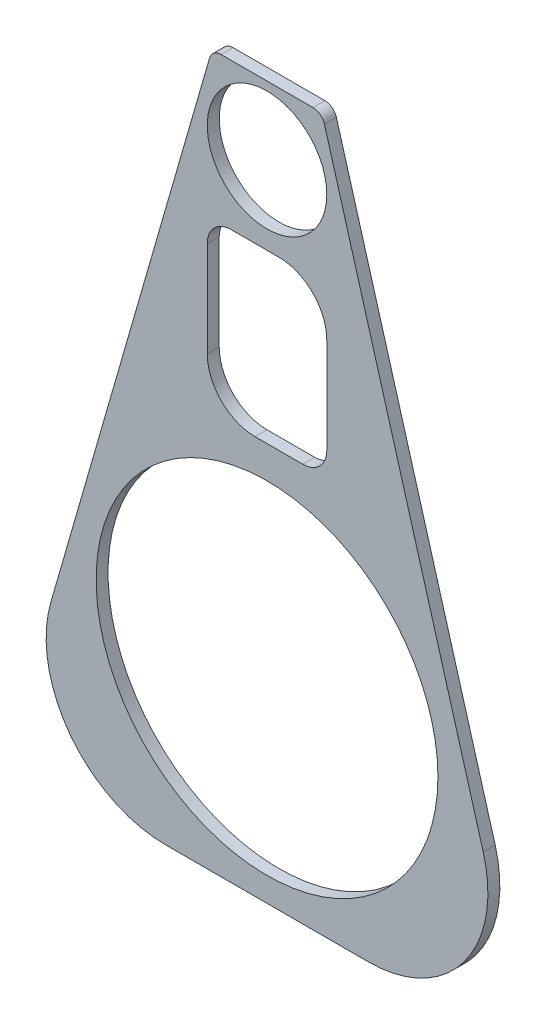
from build123d import *

# Parameters (mm, degrees)
SKETCH3_R           = 250
SKETCH3_R_2         = 715
BOSS_EXTRUDE1_DEPTH = 50


with BuildPart() as part:
    # Sketch3 → Boss-Extrude1 (new body)
    with BuildSketch(Plane.XY):
        with BuildLine():
            Line((969.886005152, -1066.457437193), (305.514251949, 1238.373568318))
            ThreePointArc((305.514251949, 1238.373568318), (287.533352897, 1264.477537776), (257.470390227, 1274.524837297))
            Line((257.470390227, 1274.524837297), (-126.839292875, 1274.524837297))
            ThreePointArc((-126.839292875, 1274.524837297), (-156.902255545, 1264.477537776), (-174.883154597, 1238.373568318))
            Line((-174.883154597, 1238.373568318), (-839.2549078, -1066.457437193))
            ThreePointArc((-839.2549078, -1066.457437193), (-758.343295367, -1505.574374096), (-358.816290584, -1704.944747397))
            Line((-358.816290584, -1704.944747397), (489.447387936, -1704.944747397))
            ThreePointArc((489.447387936, -1704.944747397), (888.974392718, -1505.574374096), (969.886005152, -1066.457437193))
        make_face()
        with Locations((65.315548676, 988.536474279)):
            Circle(SKETCH3_R, mode=Mode.SUBTRACT)
        with Locations((65.315548676, -888.891859179)):
            Circle(SKETCH3_R_2, mode=Mode.SUBTRACT)
        with BuildLine():
            Line((15.315548676, -38.891859179), (215.315548676, -38.891859179))
            ThreePointArc((215.315548676, -38.891859179), (286.026226794, -9.602537297), (315.315548676, 61.108140821))
            Line((315.315548676, 61.108140821), (315.315548676, 461.108140821))
            ThreePointArc((315.315548676, 461.108140821), (256.736904913, 602.529497059), (115.315548676, 661.108140821))
            Line((115.315548676, 661.108140821), (-84.684451324, 661.108140821))
            ThreePointArc((-84.684451324, 661.108140821), (-155.395129443, 631.81881894), (-184.684451324, 561.108140821))
            Line((-184.684451324, 561.108140821), (-184.684451324, 161.108140821))
            ThreePointArc((-184.684451324, 161.108140821), (-126.105807561, 19.686784584), (15.315548676, -38.891859179))
        make_face(mode=Mode.SUBTRACT)
    extrude(amount=BOSS_EXTRUDE1_DEPTH)


solid = part.part
